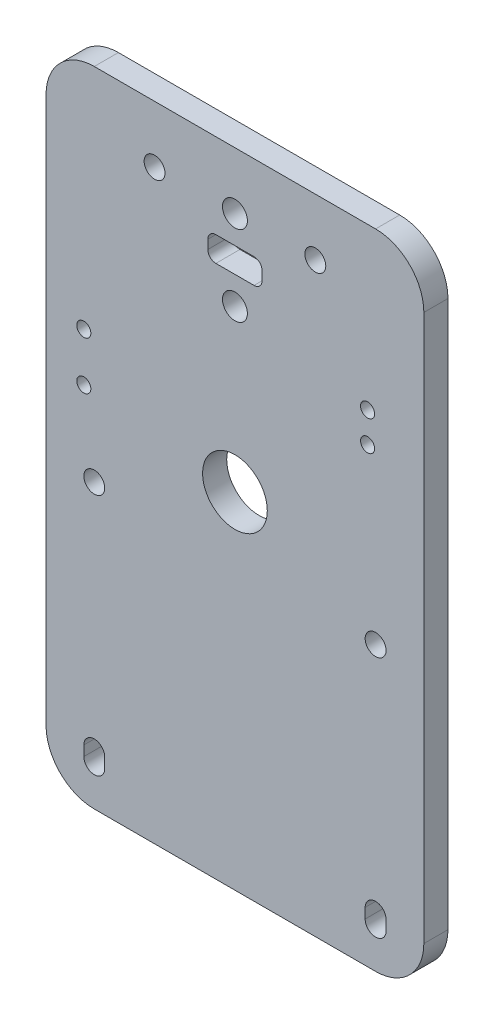
from build123d import *

# Parameters (mm, degrees)
MODEL_R           = 3.1
MODEL_R_2         = 2.6
MODEL_W           = 13.5
MODEL_H           = 6.2
BASE_DEPTH        = 6
SKETCH_1_R        = 8.05
BEARINGHOLE_DEPTH = 10
SKETCH1_R         = 1.75
SENSORMOUNT_DEPTH = 10
SKETCH3_R         = 1.75
CABLEMOUNT_DEPTH  = 10
FILLETCABLESLOT_R = 2


with BuildPart() as part:
    # Model → Base (new body)
    with BuildSketch(Plane.XY):
        with BuildLine():
            Line((-35, 160), (35, 160))
            ThreePointArc((35, 160), (43.485281374, 156.485281374), (47, 148))
            Line((47, 148), (47, 12))
            ThreePointArc((47, 12), (43.485281374, 3.514718626), (35, 0))
            Line((35, 0), (-35, 0))
            ThreePointArc((-35, 0), (-43.485281374, 3.514718626), (-47, 12))
            Line((-47, 12), (-47, 148))
            ThreePointArc((-47, 148), (-43.485281374, 156.485281374), (-35, 160))
        make_face()
        with Locations((0, 145.8)):
            Circle(MODEL_R, mode=Mode.SUBTRACT)
        with Locations((-20, 145.8)):
            Circle(MODEL_R_2, mode=Mode.SUBTRACT)
        with Locations((20, 145.8)):
            Circle(MODEL_R_2, mode=Mode.SUBTRACT)
        with Locations((-35, 70.45)):
            Circle(MODEL_R_2, mode=Mode.SUBTRACT)
        with Locations((0, 125.8)):
            Circle(MODEL_R, mode=Mode.SUBTRACT)
        with Locations((35, 70.45)):
            Circle(MODEL_R_2, mode=Mode.SUBTRACT)
        with BuildLine():
            Line((-32.4, 12.5), (-32.4, 10))
            ThreePointArc((-32.4, 10), (-35, 7.4), (-37.6, 10))
            Line((-37.6, 10), (-37.6, 12.5))
            ThreePointArc((-37.6, 12.5), (-35, 15.1), (-32.4, 12.5))
        make_face(mode=Mode.SUBTRACT)
        with BuildLine():
            Line((32.4, 12.5), (32.4, 10))
            ThreePointArc((32.4, 10), (35, 7.4), (37.6, 10))
            Line((37.6, 10), (37.6, 12.5))
            ThreePointArc((37.6, 12.5), (35, 15.1), (32.4, 12.5))
        make_face(mode=Mode.SUBTRACT)
        with Locations((0, 135.8)):
            Rectangle(MODEL_W, MODEL_H, mode=Mode.SUBTRACT)
    extrude(amount=BASE_DEPTH)

    # Эскиз1 → BearingHole (cut)
    with BuildSketch(Plane(origin=(0, 0, 0), x_dir=(-1, 0, 0), z_dir=(0, 0, -1))):
        with Locations((0, 85.8)):
            Circle(SKETCH_1_R)
    extrude(amount=-BEARINGHOLE_DEPTH, mode=Mode.SUBTRACT)

    # Sketch1 → SensorMount (cut)
    with BuildSketch(Plane.XY.offset(6)):
        with Locations((33, 120)):
            Circle(SKETCH1_R)
        with Locations((33, 112.5)):
            Circle(SKETCH1_R)
    extrude(amount=-SENSORMOUNT_DEPTH, mode=Mode.SUBTRACT)

    # Sketch3 → CableMount (cut)
    with BuildSketch(Plane(origin=(0, 0, 0), x_dir=(-1, 0, 0), z_dir=(0, 0, -1))):
        with Locations((37.6, 90.08855339)):
            Circle(SKETCH3_R)
        with Locations((37.6, 102.08855339)):
            Circle(SKETCH3_R)
    extrude(amount=-CABLEMOUNT_DEPTH, mode=Mode.SUBTRACT)

    # FilletCableSlot
    filletcableslot_edges = [part.edges().sort_by_distance(p)[0] for p in [
        (6.75, 132.7, 3),
        (6.75, 138.9, 3),
        (-6.75, 138.9, 3),
        (-6.75, 132.7, 3),
    ]]
    fillet(filletcableslot_edges, radius=FILLETCABLESLOT_R)


solid = part.part
